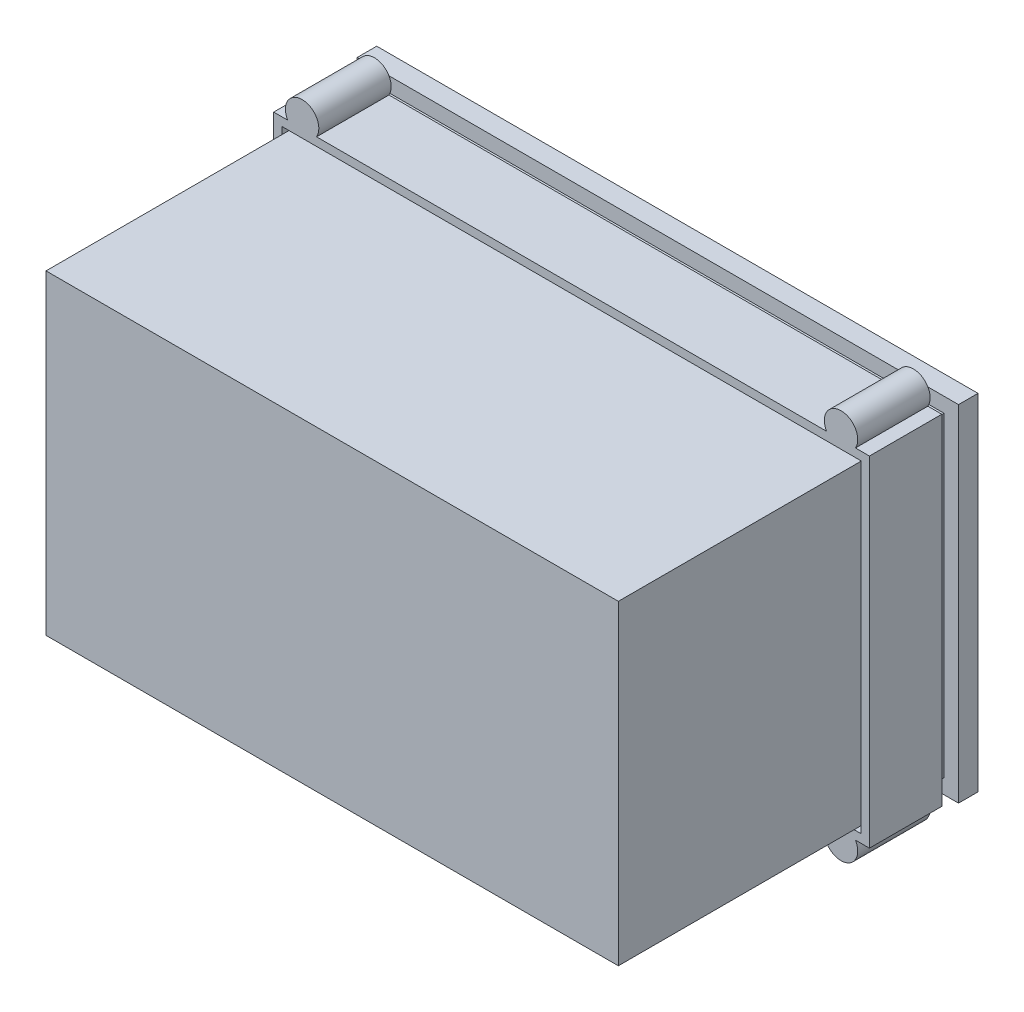
from build123d import *

# Parameters (mm, degrees)
SKETCH_1_W           = 108
SKETCH_1_H           = 62
EXTRUDE_1_DEPTH      = 62
SKETCH_2_OUTSIDE_W   = 137.822
SKETCH_2_OUTSIDE_H   = 91.822
SKETCH_2_OUTSIDE_W_2 = 102.8
SKETCH_2_OUTSIDE_H_2 = 56.7
CUT_EXTRUDE_1_DEPTH  = 58.5
SKETCH_3_W           = 79
SKETCH_3_H           = 22
CUT_EXTRUDE_2_DEPTH  = 1
SKETCH_4_W           = 62
SKETCH_4_H           = 5
CUT_EXTRUDE_3_DEPTH  = 30
SKETCH_5_W           = 102
SKETCH_5_H           = 56
SKETCH_5_W_2         = 7
SKETCH_5_H_2         = 54
SKETCH_5_W_3         = 92
CUT_EXTRUDE_4_DEPTH  = 2
SKETCH_6_R           = 1.5
EXTRUDE_2_DEPTH      = 3
SKETCH_7_W           = 104
SKETCH_7_H           = 58
EXTRUDE_4_DEPTH      = 56
SKETCH_8_OUTSIDE_W   = 138.836
SKETCH_8_OUTSIDE_H   = 100.836
SKETCH_8_OUTSIDE_W_2 = 102.8
SKETCH_8_OUTSIDE_H_2 = 56.7
CUT_EXTRUDE_5_DEPTH  = 43


with BuildPart() as part:
    # 草图1 → 凸台-拉伸1 (new body)
    with BuildSketch(Plane.XY):
        Rectangle(SKETCH_1_W, SKETCH_1_H)
    extrude(amount=EXTRUDE_1_DEPTH)

    # 草图2 outside → 切除-拉伸1 (cut)
    with BuildSketch(Plane.XY.offset(62)):
        Rectangle(SKETCH_2_OUTSIDE_W, SKETCH_2_OUTSIDE_H)
        Rectangle(SKETCH_2_OUTSIDE_W_2, SKETCH_2_OUTSIDE_H_2, mode=Mode.SUBTRACT)
    extrude(amount=-CUT_EXTRUDE_1_DEPTH, mode=Mode.SUBTRACT)

    # 草图3 → 切除-拉伸2 (cut)
    with BuildSketch(Plane(origin=(0, 0, 0), x_dir=(-1, 0, 0), z_dir=(0, 0, -1))):
        with Locations((-4.5, -10)):
            Rectangle(SKETCH_3_W, SKETCH_3_H)
    extrude(amount=-CUT_EXTRUDE_2_DEPTH, mode=Mode.SUBTRACT)

    # 草图4 → 切除-拉伸3 (cut)
    with BuildSketch(Plane(origin=(0, 0, 1), x_dir=(-1, 0, 0), z_dir=(0, 0, -1))):
        with Locations((-5, -10.5)):
            Rectangle(SKETCH_4_W, SKETCH_4_H)
    extrude(amount=-CUT_EXTRUDE_3_DEPTH, mode=Mode.SUBTRACT)

    # 草图5 → 切除-拉伸4 (cut)
    with BuildSketch(Plane(origin=(0, 0, 0), x_dir=(-1, 0, 0), z_dir=(0, 0, -1))):
        Rectangle(SKETCH_5_W, SKETCH_5_H)
        with Locations((46.5, 0)):
            Rectangle(SKETCH_5_W_2, SKETCH_5_H_2, mode=Mode.SUBTRACT)
        with Locations((-4, 0)):
            Rectangle(SKETCH_5_W_3, SKETCH_5_H_2, mode=Mode.SUBTRACT)
    extrude(amount=-CUT_EXTRUDE_4_DEPTH, mode=Mode.SUBTRACT)

    # 草图6 → 凸台-拉伸2 (add)
    with BuildSketch(Plane(origin=(0, 0, 0), x_dir=(-1, 0, 0), z_dir=(0, 0, -1))):
        with Locations((46.5, 20.426014391)):
            Circle(SKETCH_6_R)
        with Locations((46.5, 8.806407589)):
            Circle(SKETCH_6_R)
        with Locations((46.5, -5.34479317)):
            Circle(SKETCH_6_R)
        with BuildLine():
            Line((48, -15.990853784), (48, -21.990853784))
            ThreePointArc((48, -21.990853784), (46.5, -23.490853784), (45, -21.990853784))
            Line((45, -21.990853784), (45, -15.990853784))
            ThreePointArc((45, -15.990853784), (46.5, -14.490853784), (48, -15.990853784))
        make_face()
    extrude(amount=EXTRUDE_2_DEPTH)


with BuildPart() as body_2:
    # 草图7 → 凸台-拉伸4 (new body)
    with BuildSketch(Plane.XY.offset(62)):
        with BuildLine():
            Line((-50.998076211, -30.5), (-53.5, -30.5))
            Line((-53.5, -30.5), (-53.5, 30.5))
            Line((-53.5, 30.5), (-50.998076211, 30.5))
            ThreePointArc((-50.998076211, 30.5), (-48.4, 35), (-45.801923789, 30.5))
            Line((-45.801923789, 30.5), (45.801923789, 30.5))
            ThreePointArc((45.801923789, 30.5), (48.4, 35), (50.998076211, 30.5))
            Line((50.998076211, 30.5), (53.5, 30.5))
            Line((53.5, 30.5), (53.5, -30.5))
            Line((53.5, -30.5), (50.998076211, -30.5))
            ThreePointArc((50.998076211, -30.5), (48.4, -35), (45.801923789, -30.5))
            Line((45.801923789, -30.5), (-45.801923789, -30.5))
            ThreePointArc((-45.801923789, -30.5), (-48.4, -35), (-50.998076211, -30.5))
        make_face()
        Rectangle(SKETCH_7_W, SKETCH_7_H, mode=Mode.SUBTRACT)
    extrude(amount=-EXTRUDE_4_DEPTH)

    # 草图8 outside → 切除-拉伸5 (cut)
    with BuildSketch(Plane.XY.offset(62)):
        Rectangle(SKETCH_8_OUTSIDE_W, SKETCH_8_OUTSIDE_H)
        Rectangle(SKETCH_8_OUTSIDE_W_2, SKETCH_8_OUTSIDE_H_2, mode=Mode.SUBTRACT)
    extrude(amount=-CUT_EXTRUDE_5_DEPTH, mode=Mode.SUBTRACT)


solid = Compound([part.part, body_2.part])
